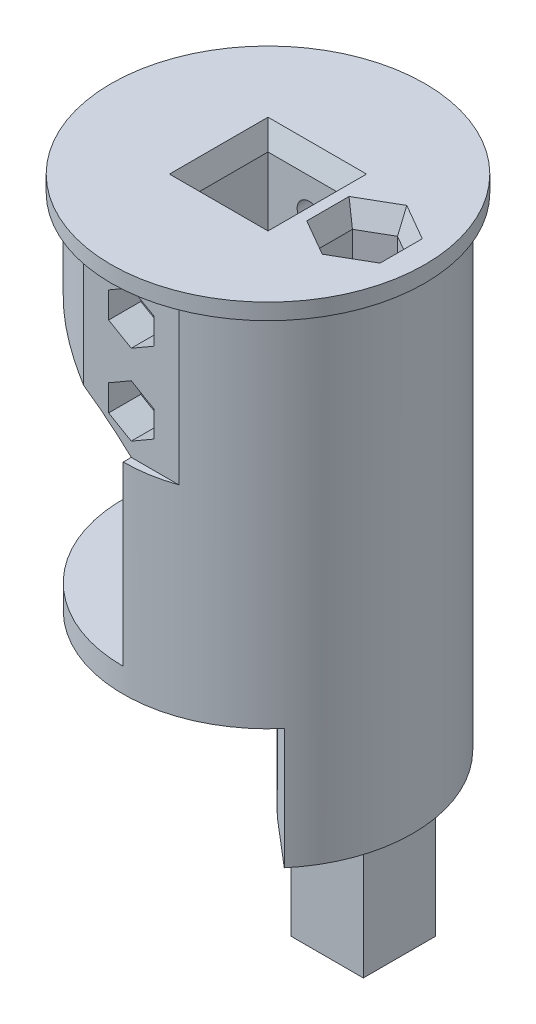
from build123d import *
from build123d.topology import SkipClean

# Parameters (mm, degrees)
SKETCH_1_R          = 18
EXTRUDE_1_DEPTH     = 45
SKETCH_2_R          = 19.5
EXTRUDE_2_DEPTH     = 2
SKETCH_3_W          = 10.25
SKETCH_3_H          = 10.25
CUT_EXTRUDE_1_DEPTH = 40
EXTRUDE_START       = 15
EXTRUDE_3_DEPTH     = 15
BOSS_EXTRUDE1_START = 20
SKETCH1_R           = 18
BOSS_EXTRUDE1_DEPTH = 20
BOSS_EXTRUDE2_START = 7
SKETCH3_R           = 18
BOSS_EXTRUDE2_DEPTH = 7
SKETCH4_W           = 10.2
SKETCH4_H           = 10.2
CUT_EXTRUDE2_DEPTH  = 27
CUT_EXTRUDE4_DEPTH  = 25
BOSS_EXTRUDE3_DEPTH = 3
SKETCH9_W           = 36
SKETCH9_H           = 22
CUT_EXTRUDE5_DEPTH  = 8
SKETCH10_R          = 3.7
SKETCH10_W          = 3
SKETCH10_H          = 2
CUT_EXTRUDE6_DEPTH  = 10
SKETCH11_R          = 2
CUT_EXTRUDE7_DEPTH  = 102
SKETCH15_R          = 18
CUT_EXTRUDE9_DEPTH  = 27
CUT_EXTRUDE11_DEPTH = 20
SKETCH18_R          = 1.5
CUT_EXTRUDE12_DEPTH = 63.62188116
SKETCH19_R          = 3
CUT_EXTRUDE13_DEPTH = 3
BOSS_EXTRUDE5_DEPTH = 22
CUT_EXTRUDE16_DEPTH = 4
CUT_EXTRUDE17_DEPTH = 6
CUT_EXTRUDE18_DEPTH = 63.62188116
FILLET2_R           = 5
SKETCH30_W          = 18.8
SKETCH30_H          = 10
CUT_EXTRUDE20_DEPTH = 3
CHAMFER1_SIZE       = 1
CHAMFER1_SIZE2      = 2.747477419
CHAMFER2_SIZE       = 1
CHAMFER2_SIZE2      = 2.747477419
BOSS_EXTRUDE7_START = 15
SKETCH37_W          = 9
SKETCH37_H          = 9
SKETCH37_R          = 2
BOSS_EXTRUDE7_DEPTH = 15
CUT_EXTRUDE22_DEPTH = 15
CUT_EXTRUDE23_REACH = 69.856
SKETCH40_W          = 4.363156696
SKETCH40_H          = 4.363156696
CUT_EXTRUDE24_DEPTH = 10
FILLET7_R           = 6


with BuildPart() as part:
    # Эскиз1 → Бобышка-Вытянуть1 (new body)
    with BuildSketch(Plane(origin=(0, 0, 0), x_dir=(1, 0, 0), z_dir=(0, 1, 0))):
        with Locations(Location((0, 0, 0), (0, 0, 90))):
            Circle(SKETCH_1_R)
    extrude(amount=EXTRUDE_1_DEPTH)

    # Эскиз2 → Бобышка-Вытянуть2 (add)
    with BuildSketch(Plane(origin=(0, 45, 0), x_dir=(1, 0, 0), z_dir=(0, 1, 0))):
        with Locations(Location((0, 0, 0), (0, 0, 270))):
            Circle(SKETCH_2_R)
    extrude(amount=EXTRUDE_2_DEPTH)

    # Эскиз3 → Вырез-Вытянуть1 (cut)
    with BuildSketch(Plane(origin=(0, 47, 0), x_dir=(1, 0, 0), z_dir=(0, 1, 0))):
        Rectangle(SKETCH_3_W, SKETCH_3_H)
    extrude(amount=-CUT_EXTRUDE_1_DEPTH, mode=Mode.SUBTRACT)

    # Эскиз4 → Бобышка-Вытянуть3 (add)
    with BuildSketch(Plane.XZ.offset(EXTRUDE_START)):
        with BuildLine():
            Line((5.142300877, -6.128355545), (11.570176974, -13.788799976))
            ThreePointArc((11.570176974, -13.788799976), (17.937391115, -1.5), (13.69961987, 11.675633406))
            Line((13.69961987, 11.675633406), (5.142300877, 4.38257561))
            Line((5.142300877, 4.38257561), (5.142300877, -6.128355545))
        make_face()
    extrude(amount=-EXTRUDE_3_DEPTH)

    # Sketch1 → Boss-Extrude1 (add)
    with BuildSketch(Plane.XZ.offset(15).offset(BOSS_EXTRUDE1_START)):
        with Locations(Location((0, 0, 0), (0, 0, 270))):
            Circle(SKETCH1_R)
    extrude(amount=-BOSS_EXTRUDE1_DEPTH)

    # Sketch3 → Boss-Extrude2 (add)
    with BuildSketch(Plane.XZ.offset(35).offset(BOSS_EXTRUDE2_START)):
        with Locations(Location((0, 0, 0), (0, 0, 270))):
            Circle(SKETCH3_R)
    extrude(amount=-BOSS_EXTRUDE2_DEPTH)

    # Sketch4 → Cut-Extrude2 (cut)
    with BuildSketch(Plane.XZ.offset(42)):
        Rectangle(SKETCH4_W, SKETCH4_H)
    extrude(amount=-CUT_EXTRUDE2_DEPTH, mode=Mode.SUBTRACT)

    # Sketch6 → Cut-Extrude4 (cut)
    with BuildSketch(Plane.XZ):
        with BuildLine():
            Line((0, 18), (0, -18))
            ThreePointArc((0, -18), (-18, 0), (0, 18))
        make_face()
    extrude(amount=-CUT_EXTRUDE4_DEPTH, mode=Mode.SUBTRACT)

    # Sketch8 → Boss-Extrude3 (add)
    with BuildSketch(Plane.XZ):
        with BuildLine():
            Line((0, -18), (0, 18))
            ThreePointArc((0, 18), (-18, 0), (0, -18))
        make_face()
    extrude(amount=-BOSS_EXTRUDE3_DEPTH)

    # Sketch9 → Cut-Extrude5 (cut)
    with BuildSketch(Plane.ZY):
        with Locations((0, 14)):
            Rectangle(SKETCH9_W, SKETCH9_H)
    extrude(amount=-CUT_EXTRUDE5_DEPTH, mode=Mode.SUBTRACT)

    # Sketch10 → Cut-Extrude6 (cut)
    with BuildSketch(Plane.XZ):
        with Locations(Location((0, 0, 0), (0, 0, 270))):
            Circle(SKETCH10_R)
        with Locations((0, 7.7)):
            Rectangle(SKETCH10_W, SKETCH10_H)
    extrude(amount=-CUT_EXTRUDE6_DEPTH, mode=Mode.SUBTRACT)

    # Sketch11 → Cut-Extrude7 (cut)
    with BuildSketch(Plane.XZ.offset(42)):
        with Locations(Location((12, 0, 0), (0, 0, 270))):
            Circle(SKETCH11_R)
    extrude(amount=-CUT_EXTRUDE7_DEPTH, mode=Mode.SUBTRACT)

    # Sketch15 → Cut-Extrude9 (cut)
    with BuildSketch(Plane.XZ.offset(42)):
        with Locations(Location((0, 0, 0), (0, 0, 310))):
            Circle(SKETCH15_R)
    extrude(amount=-CUT_EXTRUDE9_DEPTH, mode=Mode.SUBTRACT)

    # Sketch17 → Cut-Extrude11 (cut)
    with BuildSketch(Plane.XZ.offset(-25)):
        with BuildLine():
            Line((5.916079783, -17), (-5.916079783, -17))
            ThreePointArc((-5.916079783, -17), (0, -18), (5.916079783, -17))
        make_face()
        with BuildLine():
            Line((5.916079783, 17), (-5.916079783, 17))
            ThreePointArc((-5.916079783, 17), (0, 18), (5.916079783, 17))
        make_face()
    extrude(amount=-CUT_EXTRUDE11_DEPTH, mode=Mode.SUBTRACT)

    # Sketch18 → Cut-Extrude12 (cut, through all)
    with BuildSketch(Plane.XY.offset(-17)):
        with Locations(Location((0, 30, 0), (0, 0, 180))):
            Circle(SKETCH18_R)
        with Locations(Location((0, 40, 0), (0, 0, 180))):
            Circle(SKETCH18_R)
    extrude(amount=CUT_EXTRUDE12_DEPTH, mode=Mode.SUBTRACT)

    # Sketch19 → Cut-Extrude13 (cut)
    with BuildSketch(Plane.XY.offset(-17)):
        with Locations((0, 30)):
            Circle(SKETCH19_R)
        with Locations((0, 40)):
            Circle(SKETCH19_R)
    extrude(amount=CUT_EXTRUDE13_DEPTH, mode=Mode.SUBTRACT)

    # Sketch23 → Boss-Extrude5 (add)
    with BuildSketch(Plane(origin=(0, 3, 0), x_dir=(1, 0, 0), z_dir=(0, 1, 0))):
        with BuildLine():
            Line((0, -14.4), (8, -14.4))
            Line((8, -14.4), (8, -16.124515497))
            ThreePointArc((8, -16.124515497), (4.108449894, -17.524857759), (0, -18))
            Line((0, -18), (0, -14.4))
        make_face()
        with BuildLine():
            Line((0, 14.4), (8, 14.4))
            Line((8, 14.4), (8, 16.124515497))
            ThreePointArc((8, 16.124515497), (4.108449894, 17.524857759), (0, 18))
            Line((0, 18), (0, 14.4))
        make_face()
    extrude(amount=BOSS_EXTRUDE5_DEPTH)

    # Sketch25 → Cut-Extrude16 (cut)
    with BuildSketch(Plane.XY.offset(17)):
        Polygon((-2.814582562, 28.375), (0, 26.75), (2.814582562, 28.375), (2.814582562, 31.625), (0, 33.25), (-2.814582562, 31.625), align=None)
        Polygon((-2.814582562, 41.625), (-2.814582562, 38.375), (0, 36.75), (2.814582562, 38.375), (2.814582562, 41.625), (0, 43.25), align=None)
    extrude(amount=-CUT_EXTRUDE16_DEPTH, mode=Mode.SUBTRACT)

    # Sketch26 → Cut-Extrude17 (cut)
    with BuildSketch(Plane(origin=(0, 47, 0), x_dir=(1, 0, 0), z_dir=(0, 1, 0))):
        Polygon((8.449295844, -2.05), (12, -4.1), (15.550704156, -2.05), (15.550704156, 2.05), (12, 4.1), (8.449295844, 2.05), align=None)
    extrude(amount=-CUT_EXTRUDE17_DEPTH, mode=Mode.SUBTRACT)

    # Sketch27 → Cut-Extrude18 (cut, through all)
    with BuildSketch(Plane.XY.offset(17)):
        with BuildLine():
            Line((-20, 36.547005384), (-20, 25))
            Line((-20, 25), (0, 25))
            ThreePointArc((0, 25), (-9.324199199, 31.944024015), (-20, 36.547005384))
        make_face()
    extrude(amount=-CUT_EXTRUDE18_DEPTH, mode=Mode.SUBTRACT)

    # Fillet2
    fillet2_edges = [part.edges().sort_by_distance(p)[0] for p in [
        (8, 14, -14.4),
        (8, 14, 14.4),
    ]]
    fillet(fillet2_edges, radius=FILLET2_R)

    # Sketch30 → Cut-Extrude20 (cut)
    with SkipClean():  # the faces are left unmerged after this step: merging them gives an invalid solid
        with BuildSketch(Plane.ZY.offset(-8)):
            with Locations((0, 8)):
                Rectangle(SKETCH30_W, SKETCH30_H)
        extrude(amount=-CUT_EXTRUDE20_DEPTH, mode=Mode.SUBTRACT)

    # Chamfer1
    chamfer1_edges = [part.edges().sort_by_distance(p)[0] for p in [
        (5.125, 47, 0),
        (0, 47, -5.125),
        (-5.125, 47, 0),
        (0, 47, 5.125),
    ]]
    chamfer1_side = [part.faces().sort_by_distance(p)[0] for p in [
        (0, 47, -18.948456711),
    ]]
    chamfer(chamfer1_edges, length=CHAMFER1_SIZE, length2=CHAMFER1_SIZE2, reference=chamfer1_side[0])

    # Chamfer2
    chamfer2_edges = [part.edges().sort_by_distance(p)[0] for p in [
        (8.449295844, 47, 0),
        (10.224647922, 47, 3.075),
        (13.775352078, 47, 3.075),
        (15.550704156, 47, 0),
        (13.775352078, 47, -3.075),
        (10.224647922, 47, -3.075),
    ]]
    chamfer2_side = [part.faces().sort_by_distance(p)[0] for p in [
        (6.676543289, 47, 0),
    ]]
    chamfer(chamfer2_edges, length=CHAMFER2_SIZE, length2=CHAMFER2_SIZE2, reference=chamfer2_side[0])

    # Sketch37 → Boss-Extrude7 (add)
    with SkipClean():  # the faces are left unmerged after this step: merging them gives an invalid solid
        with BuildSketch(Plane.XZ.offset(15).offset(BOSS_EXTRUDE7_START)):
            with Locations((10.978822628, -0.872889968)):
                Rectangle(SKETCH37_W, SKETCH37_H)
            with Locations(Location((12, 0, 0), (0, 0, 270))):
                Circle(SKETCH37_R, mode=Mode.SUBTRACT)
        extrude(amount=-BOSS_EXTRUDE7_DEPTH)

    # Sketch38 → Cut-Extrude22 (cut)
    with SkipClean():  # the faces are left unmerged after this step: merging them gives an invalid solid
        with BuildSketch(Plane.XZ.offset(15)):
            with BuildLine():
                Line((5.142300877, -6.128355545), (5.142300877, 4.38257561))
                ThreePointArc((5.142300877, 4.38257561), (5.978822628, -0.872889968), (5.142300877, -6.128355545))
            make_face()
        extrude(amount=-CUT_EXTRUDE22_DEPTH, mode=Mode.SUBTRACT)

    # Cut-Extrude23: up to this face of the body (flat: up to its plane)
    cut_extrude23_end = Plane(part.part.faces().sort_by_distance((9.450359937, 13, 0))[0])
    # Sketch39 → Cut-Extrude23 (cut, up to the picked face)
    with BuildSketch(Plane.XZ.offset(15), mode=Mode.PRIVATE) as cut_extrude23_sk1:
        with BuildLine():
            Line((7.420733648, -7.372889968), (15.420733648, -7.372889968))
            ThreePointArc((15.420733648, -7.372889968), (13.728515389, -10.030415688), (11.598853111, -12.352178848))
            Line((11.598853111, -12.352178848), (7.420733648, -7.372889968))
        make_face()
    cut_extrude23_tool1 = split(extrude(cut_extrude23_sk1.sketch, amount=-CUT_EXTRUDE23_REACH, mode=Mode.PRIVATE), bisect_by=cut_extrude23_end, keep=Keep.BOTH, mode=Mode.PRIVATE)
    add(cut_extrude23_tool1.solids().sort_by(Axis((11.596211, -15, -9.081847), (0, 1, 0)))[0], mode=Mode.SUBTRACT)

    # Sketch40 → Cut-Extrude24 (cut)
    with SkipClean():  # the faces are left unmerged after this step: merging them gives an invalid solid
        with BuildSketch(Plane(origin=(0, 3, 0), x_dir=(1, 0, 0), z_dir=(0, 1, 0))):
            with Locations((9.602311996, 9.554468316)):
                Rectangle(SKETCH40_W, SKETCH40_H)
        extrude(amount=CUT_EXTRUDE24_DEPTH, mode=Mode.SUBTRACT)

    # Fillet7
    fillet7_edges = [part.edges().sort_by_distance(p)[0] for p in [
        (5.142300877, -7.5, 4.38257561),
        (5.142300877, -7.5, -6.128355545),
    ]]
    fillet(fillet7_edges, radius=FILLET7_R)


solid = part.part
